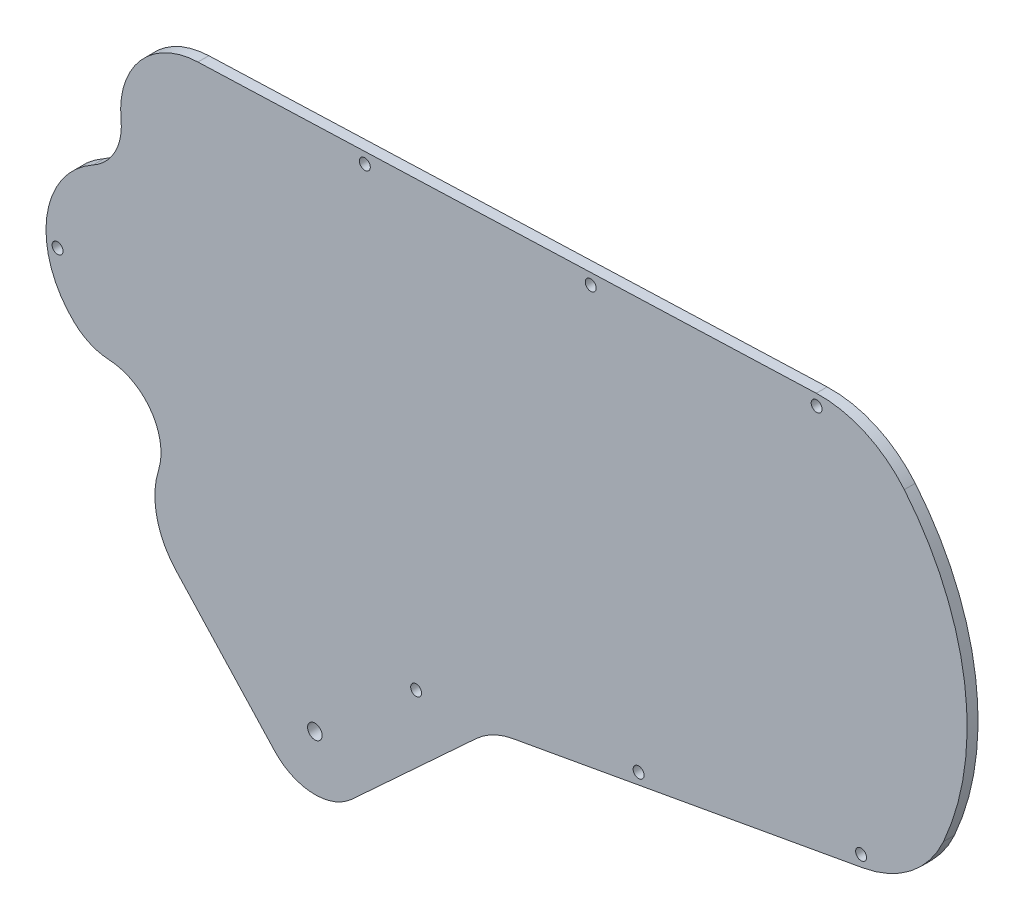
from build123d import *

# Parameters (mm, degrees)
SKETCH1_R           = 2
BOSS_EXTRUDE1_DEPTH = 3
SKETCH2_R           = 1.5
CUT_EXTRUDE1_DEPTH  = 190.515777006


with BuildPart() as part:
    # Sketch1 → Boss-Extrude1 (new body)
    with BuildSketch(Plane.XY):
        with BuildLine():
            ThreePointArc((-137.970351553, -33.480224156), (-126.431132561, -39.888203569), (-124.422839539, -52.93360637))
            ThreePointArc((-124.422839539, -52.93360637), (-124.888175134, -64.31939994), (-119.594822483, -74.410646153))
            Line((-119.594822483, -74.410646153), (-92.540517723, -103.740413224))
            ThreePointArc((-92.540517723, -103.740413224), (-82.119700521, -108.557935129), (-71.344567605, -104.595807028))
            Line((-71.344567605, -104.595807028), (-37.221129556, -73.119733925))
            ThreePointArc((-37.221129556, -73.119733925), (-32.538343047, -69.892896145), (-27.140055215, -68.104192696))
            Line((-27.140055215, -68.104192696), (68.925058584, -50.795851294))
            ThreePointArc((68.925058584, -50.795851294), (82.107908339, -44.886103489), (91, -33.5))
            ThreePointArc((91, -33.5), (96.805715124, 7.17766304), (80.26119478, 44.789595257))
            ThreePointArc((80.26119478, 44.789595257), (69.434281248, 53.01522195), (56.08825014, 55.616461034))
            Line((56.08825014, 55.616461034), (-113.612396892, 49.485657177))
            ThreePointArc((-113.612396892, 49.485657177), (-129.404309407, 41.953313258), (-134.705774542, 25.279526249))
            ThreePointArc((-134.705774542, 25.279526249), (-136.343375771, 16.802270376), (-142.382746132, 10.632050724))
            ThreePointArc((-142.382746132, 10.632050724), (-155.099864059, -8.058287742), (-147.542861296, -29.364285714))
            ThreePointArc((-147.542861296, -29.364285714), (-143.125485566, -32.280163581), (-137.970351553, -33.480224156))
        make_face()
        with Locations((-81.514845762, -93.570135067)):
            Circle(SKETCH1_R, mode=Mode.SUBTRACT)
    extrude(amount=BOSS_EXTRUDE1_DEPTH)

    # Sketch2 → Cut-Extrude1 (cut, through all)
    with BuildSketch(Plane.XY.offset(3)):
        with Locations((56.196560986, 52.618416878)):
            Circle(SKETCH2_R)
        with Locations((-5.803439014, 50.378532436)):
            Circle(SKETCH2_R)
        with Locations((-67.803439014, 48.138647993)):
            Circle(SKETCH2_R)
        with Locations((68.393104802, -47.843390427)):
            Circle(SKETCH2_R)
        with Locations((7.335774003, -58.84427394)):
            Circle(SKETCH2_R)
        with Locations((-152.133709173, -14)):
            Circle(SKETCH2_R)
        with Locations((-53.721556796, -69.845157453)):
            Circle(SKETCH2_R)
    extrude(amount=-CUT_EXTRUDE1_DEPTH, mode=Mode.SUBTRACT)


solid = part.part
